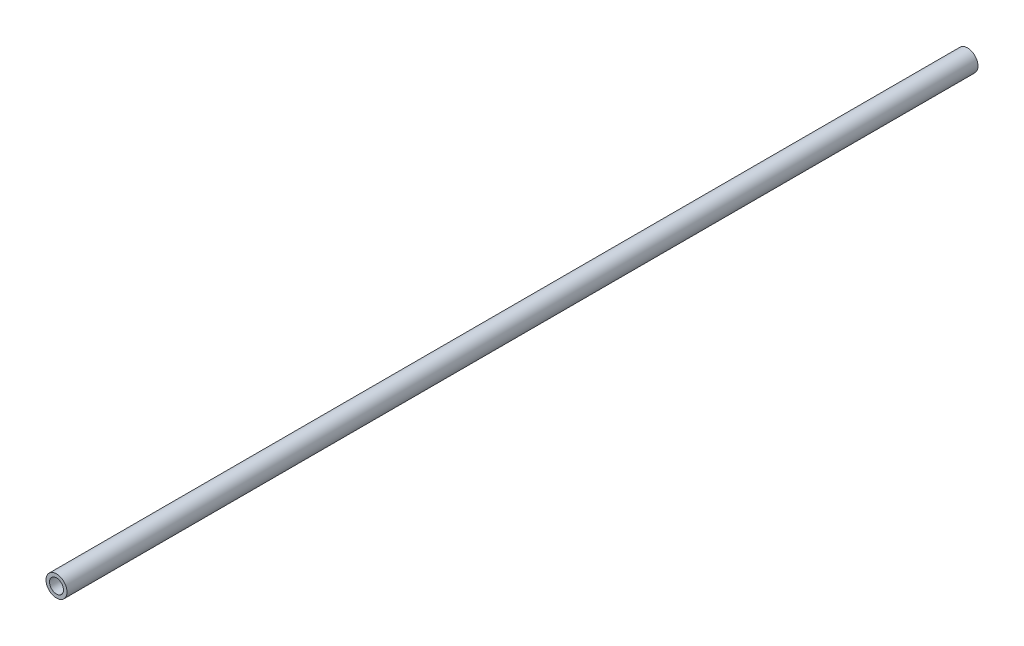
from build123d import *

# Parameters (mm, degrees)
SKETCH1_R           = 3
SKETCH1_R_2         = 2
BOSS_EXTRUDE1_DEPTH = 130


with BuildPart() as part:
    # Sketch1 → Boss-Extrude1 (new, symmetric)
    with BuildSketch(Plane.XY):
        Circle(SKETCH1_R)
        Circle(SKETCH1_R_2, mode=Mode.SUBTRACT)
    extrude(amount=BOSS_EXTRUDE1_DEPTH, both=True)


solid = part.part
